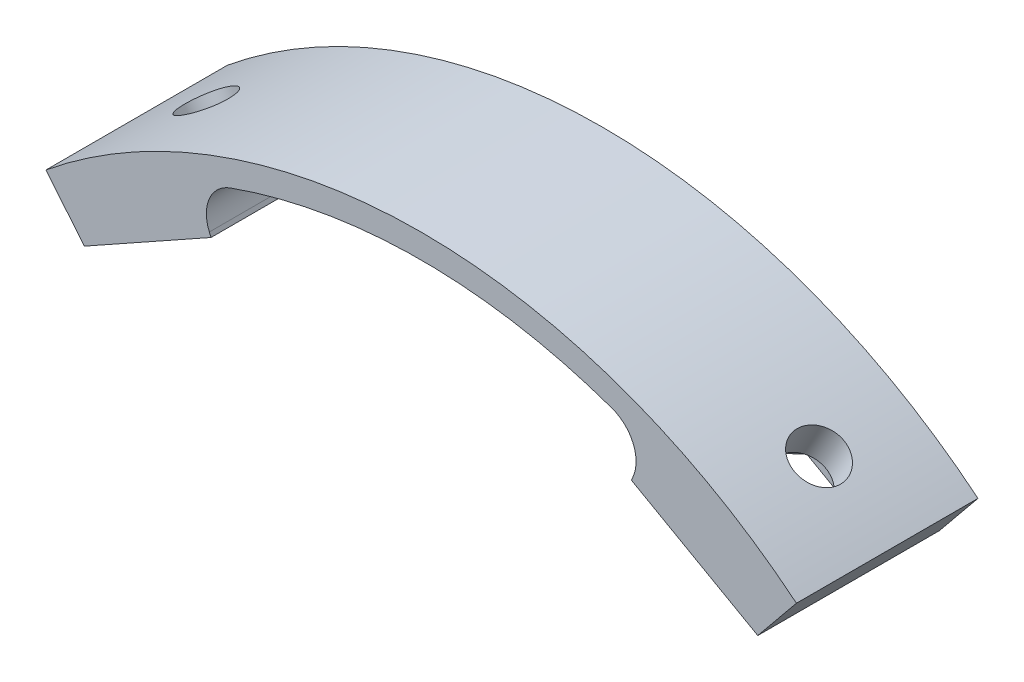
from build123d import *

# Parameters (mm, degrees)
EXTRUDE_2_DEPTH     = 15
FILLET_2_R          = 3
SKETCH_6_R          = 2.1
CUT_EXTRUDE_5_DEPTH = 13.55
SKETCH_7_R          = 2.1
CUT_EXTRUDE_6_DEPTH = 13.55
CUT_EXTRUDE_7_DEPTH = 2.55
CUT_EXTRUDE_8_DEPTH = 2.55


with BuildPart() as part:
    # Эскиз1 → Бобышка-Вытянуть2 (new body)
    with BuildSketch(Plane.XY):
        with BuildLine():
            Line((-34.742798859, 11.871098047), (-33.477492737, 10.322227357))
            Line((-33.477492737, 10.322227357), (-31.579533553, 7.998921321))
            Line((-31.579533553, 7.998921321), (-21.106042067, 13.856051683))
            Line((-21.106042067, 13.856051683), (-22.484178739, 17.02551412))
            ThreePointArc((-22.484178739, 17.02551412), (-3.742798859, 20.923766125), (14.99858102, 17.02551412))
            Line((14.99858102, 17.02551412), (13.620444348, 13.856051683))
            Line((13.620444348, 13.856051683), (24.062716277, 7.960705226))
            Line((24.062716277, 7.960705226), (25.991895018, 10.322227357))
            Line((25.991895018, 10.322227357), (27.257201141, 11.871098047))
            ThreePointArc((27.257201141, 11.871098047), (-3.742798859, 22.923766125), (-34.742798859, 11.871098047))
        make_face()
    extrude(amount=EXTRUDE_2_DEPTH)

    # Скругление2
    fillet_2_edges = [part.edges().sort_by_distance(p)[0] for p in [
        (14.99858102, 17.02551412, 7.5),
        (-22.484178739, 17.02551412, 7.5),
    ]]
    fillet(fillet_2_edges, radius=FILLET_2_R)

    # Эскиз6 → Вырез-Вытянуть5 (cut)
    with BuildSketch(Plane(origin=(9.223958982, 16.338155636, 0), x_dir=(0.8708059042632018, -0.4916269694599224, 0), z_dir=(-0.49162696945992235, -0.8708059042632017, 0))):
        with Locations((11.048754659, 7.5)):
            Circle(SKETCH_6_R)
    extrude(amount=-CUT_EXTRUDE_5_DEPTH, mode=Mode.SUBTRACT)

    # Эскиз7 → Вырез-Вытянуть6 (cut)
    with BuildSketch(Plane(origin=(-10.930954108, 19.546304709, 0), x_dir=(0.8727909572035157, 0.48809419687573696, 0), z_dir=(0.488094196875737, -0.8727909572035158, 0))):
        with Locations((-17.65810424, 7.409111806)):
            Circle(SKETCH_7_R)
    extrude(amount=-CUT_EXTRUDE_6_DEPTH, mode=Mode.SUBTRACT)

    # Эскиз8 → Вырез-Вытянуть7 (cut)
    with BuildSketch(Plane(origin=(-10.930954108, 19.546304709, 0), x_dir=(0.8727909572035158, 0.488094196875737, 0), z_dir=(0.488094196875737, -0.8727909572035158, 0))):
        Polygon((-19.707697696, 3.859111806), (-15.608510784, 3.859111806), (-13.558917329, 7.409111806), (-15.608510784, 10.959111806), (-19.707697696, 10.959111806), (-21.757291151, 7.409111806), align=None)
    extrude(amount=-CUT_EXTRUDE_7_DEPTH, mode=Mode.SUBTRACT)

    # Эскиз9 → Вырез-Вытянуть8 (cut)
    with BuildSketch(Plane(origin=(9.223958982, 16.338155636, 0), x_dir=(0.8708059042632018, -0.49162696945992246, 0), z_dir=(-0.4916269694599224, -0.8708059042632017, 0))):
        Polygon((8.999161204, 3.95), (13.098348115, 3.95), (15.147941571, 7.5), (13.098348115, 11.05), (8.999161204, 11.05), (6.949567748, 7.5), align=None)
    extrude(amount=-CUT_EXTRUDE_8_DEPTH, mode=Mode.SUBTRACT)


solid = part.part
